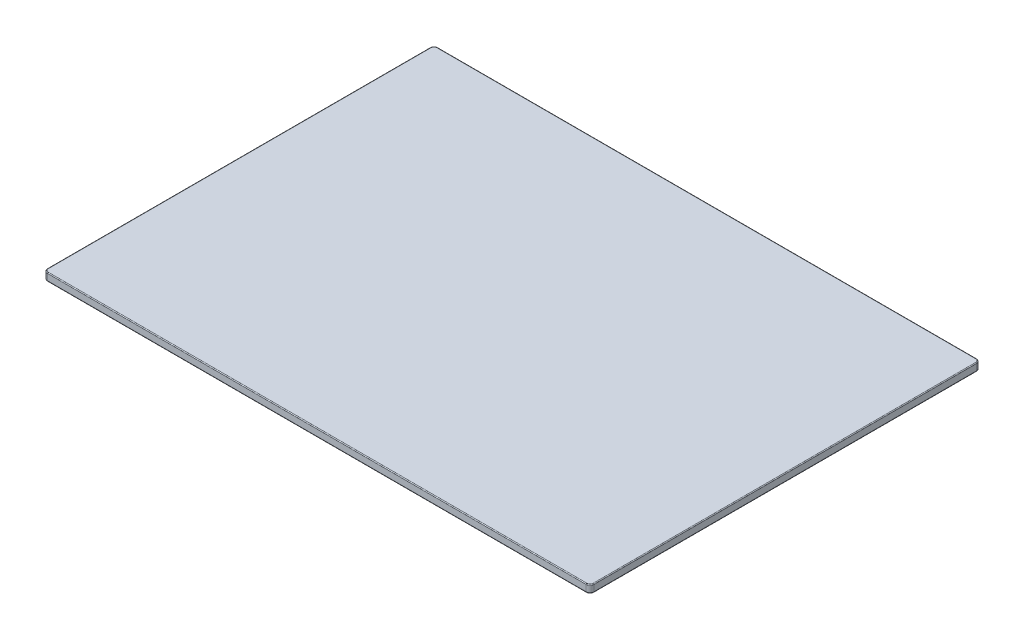
from build123d import *

# Parameters (mm, degrees)
SKETCH1_W           = 700
SKETCH1_H           = 500
BOSS_EXTRUDE1_DEPTH = 10
FILLET2_R           = 5
FILLET3_R           = 1


with BuildPart() as part:
    # Sketch1 → Boss-Extrude1 (new body)
    with BuildSketch(Plane(origin=(0, 0, 0), x_dir=(1, 0, 0), z_dir=(0, 1, 0))):
        Rectangle(SKETCH1_W, SKETCH1_H)
    extrude(amount=BOSS_EXTRUDE1_DEPTH)

    # Fillet2
    fillet2_edges = [part.edges().sort_by_distance(p)[0] for p in [
        (350, 5, 250),
        (-350, 5, 250),
        (-350, 5, -250),
        (350, 5, -250),
    ]]
    fillet(fillet2_edges, radius=FILLET2_R)

    # Fillet3
    fillet3_edges = [part.edges().sort_by_distance(p)[0] for p in [
        (-350, 0, 0),
        (-350, 10, 0),
        (350, 0, 0),
        (0, 0, 250),
        (0, 0, -250),
        (-348.535533906, 0, 248.535533906),
        (348.535533906, 0, 248.535533906),
        (348.535533906, 0, -248.535533906),
        (-348.535533906, 0, -248.535533906),
        (0, 10, -250),
        (350, 10, 0),
        (0, 10, 250),
        (-348.535533906, 10, 248.535533906),
        (348.535533906, 10, 248.535533906),
        (348.535533906, 10, -248.535533906),
        (-348.535533906, 10, -248.535533906),
    ]]
    fillet(fillet3_edges, radius=FILLET3_R)


solid = part.part
